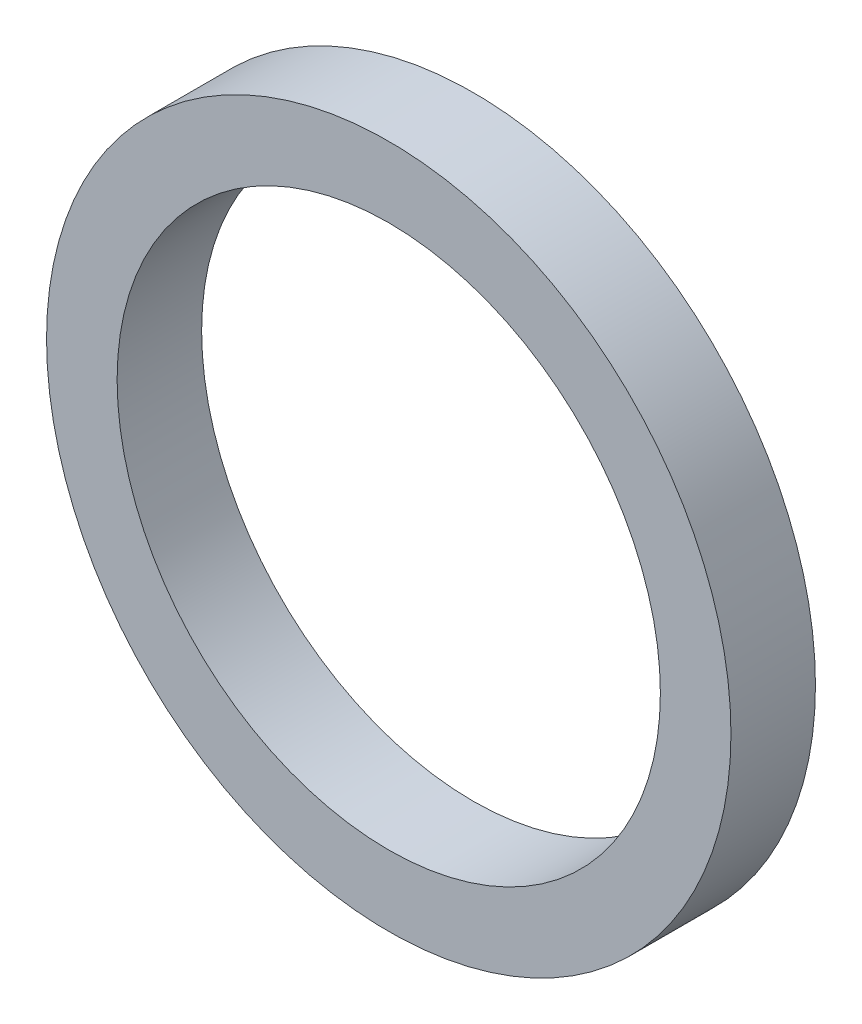
from build123d import *

# Parameters (mm, degrees)
SKETCH1_R           = 36
SKETCH1_R_2         = 28.575
BOSS_EXTRUDE1_DEPTH = 8.89


with BuildPart() as part:
    # Sketch1 → Boss-Extrude1 (new body)
    with BuildSketch(Plane.XY):
        Circle(SKETCH1_R)
        Circle(SKETCH1_R_2, mode=Mode.SUBTRACT)
    extrude(amount=BOSS_EXTRUDE1_DEPTH)


solid = part.part
